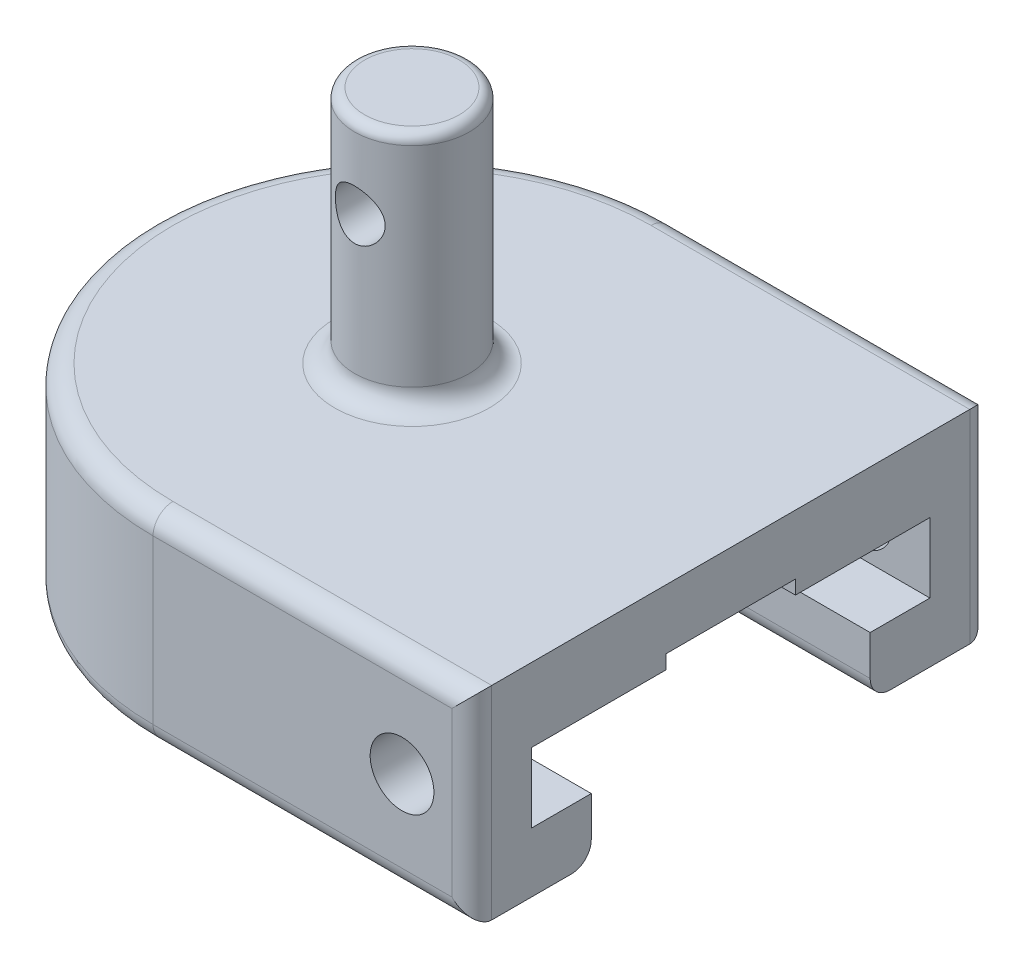
from build123d import *

# Parameters (mm, degrees)
BOSS_EXTRUDE1_DEPTH   = 3
BOSS_EXTRUDE2_DEPTH   = 3.5
BOSS_EXTRUDE3_DEPTH   = 3.7
SKETCH4_R             = 2.88
BOSS_EXTRUDE4_DEPTH   = 12
SKETCH9_W             = 6.5
SKETCH9_H             = 0.7
CUT_EXTRUDE2_DEPTH    = 23
F_2_5MM_DOWEL_HOLE1_D = 2.5
SKETCH8_R             = 1.6
CUT_EXTRUDE1_DEPTH    = 38.747052924
FILLET1_R             = 1
FILLET2_R             = 1
FILLET3_R             = 0.5


with BuildPart() as part:
    # Sketch1 → Boss-Extrude1 (new body)
    with BuildSketch(Plane(origin=(0, 0, 0), x_dir=(1, 0, 0), z_dir=(0, 1, 0))):
        with BuildLine():
            Line((0, 13), (16, 13))
            Line((16, 13), (16, 7))
            Line((16, 7), (0, 7))
            ThreePointArc((0, 7), (-7, 0), (0, -7))
            Line((0, -7), (16, -7))
            Line((16, -7), (16, -13))
            Line((16, -13), (0, -13))
            ThreePointArc((0, -13), (-13, 0), (0, 13))
        make_face()
    extrude(amount=BOSS_EXTRUDE1_DEPTH)

    # Sketch2 → Boss-Extrude2 (add)
    with BuildSketch(Plane(origin=(0, 3, 0), x_dir=(1, 0, 0), z_dir=(0, 1, 0))):
        with BuildLine():
            Line((0, 13), (16, 13))
            Line((16, 13), (16, 10))
            Line((16, 10), (0, 10))
            ThreePointArc((0, 10), (-10, 0), (0, -10))
            Line((0, -10), (16, -10))
            Line((16, -10), (16, -13))
            Line((16, -13), (0, -13))
            ThreePointArc((0, -13), (-13, 0), (0, 13))
        make_face()
    extrude(amount=BOSS_EXTRUDE2_DEPTH)

    # Sketch3 → Boss-Extrude3 (add)
    with BuildSketch(Plane(origin=(0, 6.5, 0), x_dir=(1, 0, 0), z_dir=(0, 1, 0))):
        with BuildLine():
            Line((16, 13), (0, 13))
            ThreePointArc((0, 13), (-13, 0), (0, -13))
            Line((0, -13), (16, -13))
            Line((16, -13), (16, -7))
            Line((16, -7), (16, 7))
            Line((16, 7), (16, 13))
        make_face()
    extrude(amount=BOSS_EXTRUDE3_DEPTH)

    # Sketch4 → Boss-Extrude4 (add)
    with BuildSketch(Plane(origin=(0, 10.2, 0), x_dir=(1, 0, 0), z_dir=(0, 1, 0))):
        with Locations(Location((0, 0, 0), (0, 0, 270))):
            Circle(SKETCH4_R)
    extrude(amount=BOSS_EXTRUDE4_DEPTH)

    # Sketch9 → Cut-Extrude2 (cut)
    with BuildSketch(Plane(origin=(16, 0, 0), x_dir=(0, 0, -1), z_dir=(1, 0, 0))):
        with Locations((0, 6.85)):
            Rectangle(SKETCH9_W, SKETCH9_H)
    extrude(amount=-CUT_EXTRUDE2_DEPTH, mode=Mode.SUBTRACT)

    # Ø2.5mm Dowel Hole1 (through all)
    with Locations(Plane(origin=(-0.002429038, 18.104937254, 2.879998976), x_dir=(0.999999644325, 0, 0.000843415861), z_dir=(-0.000843415861, 0, 0.999999644325))):
        with Locations((0, 0)):
            Hole(F_2_5MM_DOWEL_HOLE1_D / 2)

    # Sketch8 → Cut-Extrude1 (cut, through all)
    with BuildSketch(Plane.XY.offset(13)):
        with Locations((12.5, 5.1)):
            Circle(SKETCH8_R)
    extrude(amount=-CUT_EXTRUDE1_DEPTH, mode=Mode.SUBTRACT)

    # Fillet1
    fillet1_edges = [part.edges().sort_by_distance(p)[0] for p in [
        (8, 0, -13),
        (8, 0, -7),
        (-7, 0, 0),
        (16, 5.1, 13),
        (16, 5.1, -13),
        (-13, 10.2, 0),
        (8, 10.2, 13),
        (8, 10.2, -13),
        (8, 0, 7),
        (8, 0, 13),
        (-13, 0, 0),
    ]]
    fillet(fillet1_edges, radius=FILLET1_R)

    # Fillet2
    fillet2_edges = [part.edges().sort_by_distance(p)[0] for p in [
        (0, 10.2, -2.88),
    ]]
    fillet(fillet2_edges, radius=FILLET2_R)

    # Fillet3
    fillet3_edges = [part.edges().sort_by_distance(p)[0] for p in [
        (0, 22.2, -2.88),
    ]]
    fillet(fillet3_edges, radius=FILLET3_R)


solid = part.part
